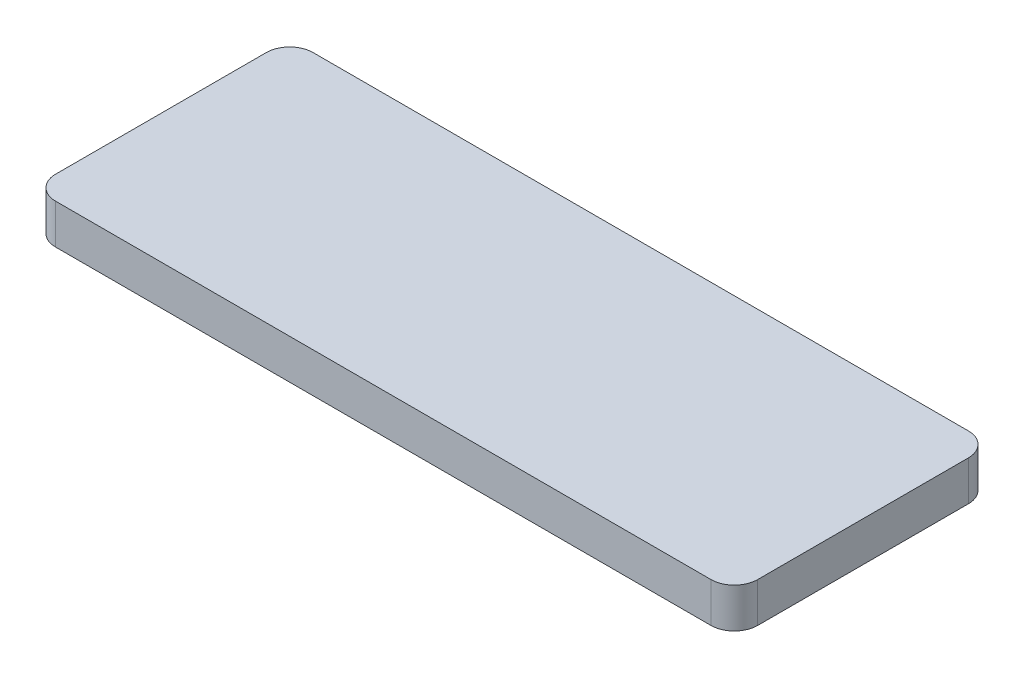
from build123d import *

# Parameters (mm, degrees)
BOSS_EXTRUDE1_DEPTH = 8.5


with BuildPart() as part:
    # Sketch1 → Boss-Extrude1 (new body)
    with BuildSketch(Plane(origin=(0, 0, 0), x_dir=(1, 0, 0), z_dir=(0, 1, 0))):
        with BuildLine():
            Line((-70, -27.5), (70, -27.5))
            ThreePointArc((70, -27.5), (73.535533906, -26.035533906), (75, -22.5))
            Line((75, -22.5), (75, 22.5))
            ThreePointArc((75, 22.5), (73.535533906, 26.035533906), (70, 27.5))
            Line((70, 27.5), (-70, 27.5))
            ThreePointArc((-70, 27.5), (-73.535533906, 26.035533906), (-75, 22.5))
            Line((-75, 22.5), (-75, -22.5))
            ThreePointArc((-75, -22.5), (-73.535533906, -26.035533906), (-70, -27.5))
        make_face()
    extrude(amount=BOSS_EXTRUDE1_DEPTH)


solid = part.part
